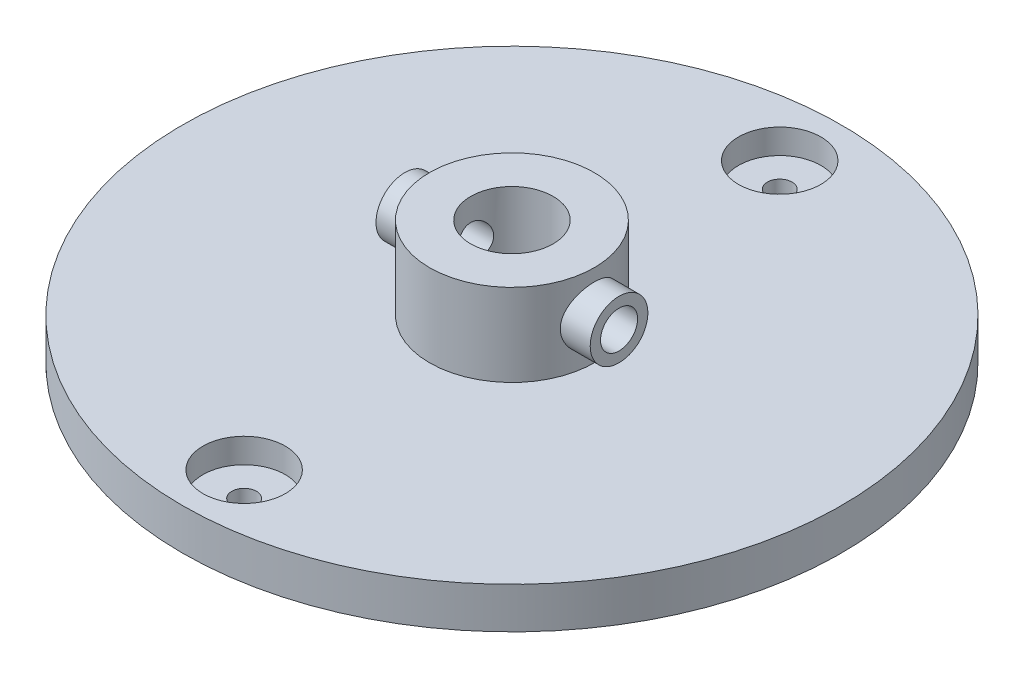
from build123d import *

# Parameters (mm, degrees)
SKETCH1_R           = 40
BOSS_EXTRUDE1_DEPTH = 5
SKETCH2_R           = 5
CUT_EXTRUDE1_DEPTH  = 15
SKETCH3_R           = 5
CUT_EXTRUDE2_DEPTH  = 3
SKETCH5_R           = 1.5
CUT_EXTRUDE3_DEPTH  = 33
BOSS_EXTRUDE2_START = 10
SKETCH6_R           = 10
SKETCH6_R_2         = 5
BOSS_EXTRUDE2_DEPTH = 10
SKETCH10_R          = 2.25
CUT_EXTRUDE4_DEPTH  = 45
BOSS_EXTRUDE3_START = 8
SKETCH11_R          = 3.5
SKETCH11_R_2        = 2.25
BOSS_EXTRUDE3_DEPTH = 8


with BuildPart() as part:
    # Sketch1 → Boss-Extrude1 (new body)
    with BuildSketch(Plane(origin=(0, 0, 0), x_dir=(1, 0, 0), z_dir=(0, 1, 0))):
        with Locations((4.147627533, -5.460766911)):
            Circle(SKETCH1_R)
    extrude(amount=BOSS_EXTRUDE1_DEPTH)

    # Sketch2 → Cut-Extrude1 (cut)
    with BuildSketch(Plane(origin=(0, 5, 0), x_dir=(1, 0, 0), z_dir=(0, 1, 0))):
        with Locations((4.147627533, -5.460766911)):
            Circle(SKETCH2_R)
    extrude(amount=-CUT_EXTRUDE1_DEPTH, mode=Mode.SUBTRACT)

    # Sketch3 → Cut-Extrude2 (cut)
    with BuildSketch(Plane(origin=(0, 5, 0), x_dir=(1, 0, 0), z_dir=(0, 1, 0))):
        with Locations((4.147627533, 27.039233089)):
            Circle(SKETCH3_R)
        with Locations((4.147627533, -37.960766911)):
            Circle(SKETCH3_R)
    extrude(amount=-CUT_EXTRUDE2_DEPTH, mode=Mode.SUBTRACT)

    # Sketch5 → Cut-Extrude3 (cut)
    with BuildSketch(Plane(origin=(0, 2, 0), x_dir=(1, 0, 0), z_dir=(0, 1, 0))):
        with Locations((4.147627533, -37.960766911)):
            Circle(SKETCH5_R)
        with Locations((4.147627533, 27.039233089)):
            Circle(SKETCH5_R)
    extrude(amount=-CUT_EXTRUDE3_DEPTH, mode=Mode.SUBTRACT)

    # Sketch6 → Boss-Extrude2 (add)
    with BuildSketch(Plane(origin=(0, 5, 0), x_dir=(1, 0, 0), z_dir=(0, 1, 0)).offset(BOSS_EXTRUDE2_START)):
        with Locations((4.147627533, -5.460766911)):
            Circle(SKETCH6_R)
        with Locations((4.147627533, -5.460766911)):
            Circle(SKETCH6_R_2, mode=Mode.SUBTRACT)
    extrude(amount=-BOSS_EXTRUDE2_DEPTH)

    # Sketch10 → Cut-Extrude4 (cut, symmetric)
    with BuildSketch(Plane(origin=(4.147627533, 0, 5.460766911), x_dir=(0, 0, -1), z_dir=(1, 0, 0))):
        with Locations((0, 10)):
            Circle(SKETCH10_R)
    extrude(amount=CUT_EXTRUDE4_DEPTH, both=True, mode=Mode.SUBTRACT)

    # Sketch11 → Boss-Extrude3 (add)
    with BuildSketch(Plane(origin=(9.147627533, 0, 5.460766911), x_dir=(0, 0, -1), z_dir=(1, 0, 0)).offset(BOSS_EXTRUDE3_START)):
        with Locations((0, 10)):
            Circle(SKETCH11_R)
        with Locations((0, 10)):
            Circle(SKETCH11_R_2, mode=Mode.SUBTRACT)
    boss_extrude3 = extrude(amount=-BOSS_EXTRUDE3_DEPTH)

    # Mirror1: Boss-Extrude3 across plane
    add(boss_extrude3.mirror(Plane(origin=(4.147627533, 0, 5.460766911), x_dir=(0, 0, 1), z_dir=(1, 0, 0))))


solid = part.part
